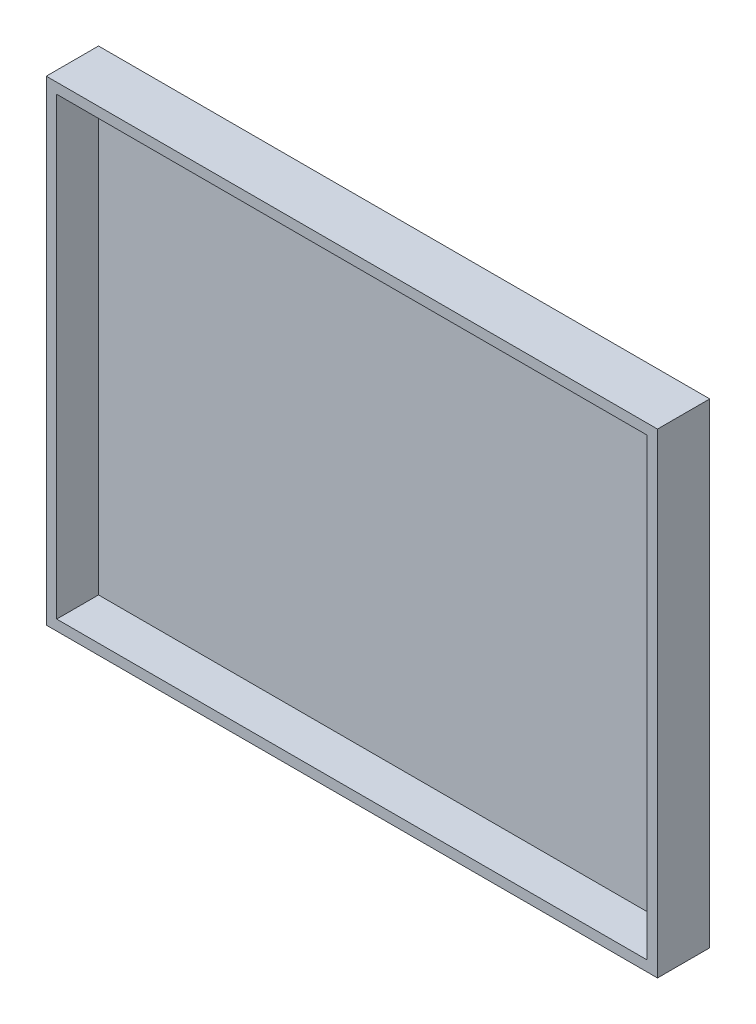
from build123d import *

# Parameters (mm, degrees)
ESQUISSE1_W             = 117
ESQUISSE1_H             = 91
BOSS_EXTRU_1_DEPTH      = 10
ESQUISSE4_W             = 113
ESQUISSE4_H             = 87
ENL_V_MAT_EXTRU_1_DEPTH = 8


with BuildPart() as part:
    # Esquisse1 → Boss.-Extru.1 (new body)
    with BuildSketch(Plane.XY):
        with Locations((58.5, 45.5)):
            Rectangle(ESQUISSE1_W, ESQUISSE1_H)
    extrude(amount=BOSS_EXTRU_1_DEPTH)

    # Esquisse4 → Enlèv. mat.-Extru.1 (cut)
    with BuildSketch(Plane.XY.offset(10)):
        with Locations((58.5, 45.5)):
            Rectangle(ESQUISSE4_W, ESQUISSE4_H)
    extrude(amount=-ENL_V_MAT_EXTRU_1_DEPTH, mode=Mode.SUBTRACT)


solid = part.part
